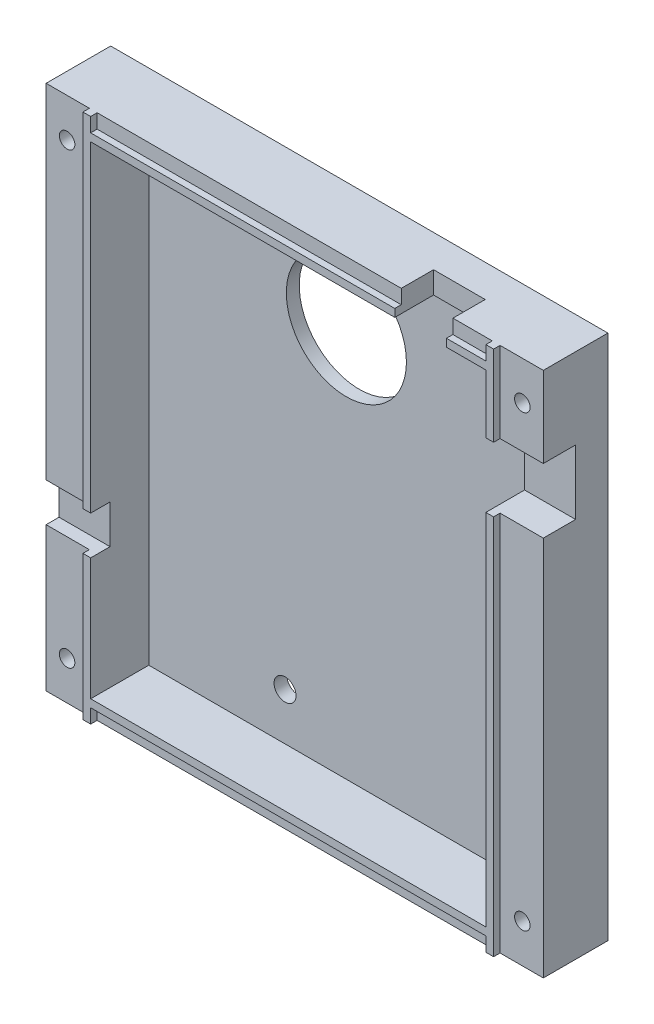
from build123d import *

# Parameters (mm, degrees)
SKETCH1_W            = 81.5
SKETCH1_H            = 77
BOSS_EXTRUDE1_DEPTH  = 2
SKETCH2_W            = 81.5
SKETCH2_H            = 6.7
BOSS_EXTRUDE2_DEPTH  = 8
SKETCH3_W            = 22.3
SKETCH3_H            = 6.7
BOSS_EXTRUDE3_DEPTH  = 10
SKETCH4_W            = 53.2
SKETCH4_H            = 6.7
BOSS_EXTRUDE4_DEPTH  = 10
SKETCH5_W            = 81.5
SKETCH5_H            = 1.2
BOSS_EXTRUDE5_DEPTH  = 8
SKETCH6_W            = 22.3
SKETCH6_H            = 1.2
BOSS_EXTRUDE6_DEPTH  = 11
SKETCH7_W            = 53.2
SKETCH7_H            = 1.2
BOSS_EXTRUDE7_DEPTH  = 11
SKETCH8_W            = 81.5
SKETCH8_H            = 6.7
BOSS_EXTRUDE8_DEPTH  = 5
SKETCH9_W            = 59
SKETCH9_H            = 6.7
BOSS_EXTRUDE9_DEPTH  = 10
SKETCH10_W           = 12.5
SKETCH10_H           = 6.7
BOSS_EXTRUDE10_DEPTH = 10
SKETCH11_W           = 81.5
SKETCH11_H           = 1.2
BOSS_EXTRUDE11_DEPTH = 5
SKETCH12_W           = 59
SKETCH12_H           = 1.2
BOSS_EXTRUDE12_DEPTH = 11
SKETCH13_W           = 12.5
SKETCH13_H           = 1.2
BOSS_EXTRUDE13_DEPTH = 11
SKETCH14_W           = 2.2
SKETCH14_H           = 63.6
BOSS_EXTRUDE14_DEPTH = 10
SKETCH15_W           = 1.2
SKETCH15_H           = 61.2
BOSS_EXTRUDE15_DEPTH = 11
SKETCH16_W           = 2.2
SKETCH16_H           = 63.6
BOSS_EXTRUDE16_DEPTH = 5
SKETCH17_W           = 2.2
SKETCH17_H           = 48.3
BOSS_EXTRUDE17_DEPTH = 10
SKETCH18_W           = 2.2
SKETCH18_H           = 7.3
BOSS_EXTRUDE18_DEPTH = 10
SKETCH19_W           = 1.2
SKETCH19_H           = 61.2
BOSS_EXTRUDE19_DEPTH = 5
SKETCH20_W           = 1.2
SKETCH20_H           = 47.1
BOSS_EXTRUDE20_DEPTH = 11
SKETCH21_W           = 1.2
SKETCH21_H           = 6.1
BOSS_EXTRUDE21_DEPTH = 11
SKETCH22_R           = 1.7
CUT_EXTRUDE1_DEPTH   = 17
SKETCH23_R           = 9.3
CUT_EXTRUDE2_DEPTH   = 17
SKETCH24_R           = 1.2
CUT_EXTRUDE3_DEPTH   = 17
SKETCH25_R           = 2
CUT_EXTRUDE4_DEPTH   = 1
SKETCH26_R           = 1.2
CUT_EXTRUDE5_DEPTH   = 17
SKETCH27_R           = 2
CUT_EXTRUDE6_DEPTH   = 1
SKETCH28_R           = 1.2
CUT_EXTRUDE7_DEPTH   = 17
SKETCH29_R           = 2
CUT_EXTRUDE8_DEPTH   = 1
SKETCH30_R           = 1.2
CUT_EXTRUDE9_DEPTH   = 17
SKETCH31_R           = 2
CUT_EXTRUDE10_DEPTH  = 1


with BuildPart() as part:
    # Sketch1 → Boss-Extrude1 (new body)
    with BuildSketch(Plane(origin=(0, 0, 0), x_dir=(0, 1, 0), z_dir=(0, 0, 1))):
        with Locations((40.75, -38.5)):
            Rectangle(SKETCH1_W, SKETCH1_H)
    extrude(amount=BOSS_EXTRUDE1_DEPTH)

    # Sketch2 → Boss-Extrude2 (add)
    with BuildSketch(Plane(origin=(0, 0, 0), x_dir=(0, 1, 0), z_dir=(0, 0, 1))):
        with Locations((40.75, -3.35)):
            Rectangle(SKETCH2_W, SKETCH2_H)
    extrude(amount=BOSS_EXTRUDE2_DEPTH)

    # Sketch3 → Boss-Extrude3 (add)
    with BuildSketch(Plane(origin=(0, 0, 0), x_dir=(0, 1, 0), z_dir=(0, 0, 1))):
        with Locations((11.15, -3.35)):
            Rectangle(SKETCH3_W, SKETCH3_H)
    extrude(amount=BOSS_EXTRUDE3_DEPTH)

    # Sketch4 → Boss-Extrude4 (add)
    with BuildSketch(Plane(origin=(0, 0, 0), x_dir=(0, 1, 0), z_dir=(0, 0, 1))):
        with Locations((54.9, -3.35)):
            Rectangle(SKETCH4_W, SKETCH4_H)
    extrude(amount=BOSS_EXTRUDE4_DEPTH)

    # Sketch5 → Boss-Extrude5 (add)
    with BuildSketch(Plane(origin=(0, 0, 0), x_dir=(0, 1, 0), z_dir=(0, 0, 1))):
        with Locations((40.75, -7.3)):
            Rectangle(SKETCH5_W, SKETCH5_H)
    extrude(amount=BOSS_EXTRUDE5_DEPTH)

    # Sketch6 → Boss-Extrude6 (add)
    with BuildSketch(Plane(origin=(0, 0, 0), x_dir=(0, 1, 0), z_dir=(0, 0, 1))):
        with Locations((11.15, -7.3)):
            Rectangle(SKETCH6_W, SKETCH6_H)
    extrude(amount=BOSS_EXTRUDE6_DEPTH)

    # Sketch7 → Boss-Extrude7 (add)
    with BuildSketch(Plane(origin=(0, 0, 0), x_dir=(0, 1, 0), z_dir=(0, 0, 1))):
        with Locations((54.9, -7.3)):
            Rectangle(SKETCH7_W, SKETCH7_H)
    extrude(amount=BOSS_EXTRUDE7_DEPTH)

    # Sketch8 → Boss-Extrude8 (add)
    with BuildSketch(Plane(origin=(0, 0, 0), x_dir=(0, 1, 0), z_dir=(0, 0, 1))):
        with Locations((40.75, -73.65)):
            Rectangle(SKETCH8_W, SKETCH8_H)
    extrude(amount=BOSS_EXTRUDE8_DEPTH)

    # Sketch9 → Boss-Extrude9 (add)
    with BuildSketch(Plane(origin=(0, 0, 0), x_dir=(0, 1, 0), z_dir=(0, 0, 1))):
        with Locations((29.5, -73.65)):
            Rectangle(SKETCH9_W, SKETCH9_H)
    extrude(amount=BOSS_EXTRUDE9_DEPTH)

    # Sketch10 → Boss-Extrude10 (add)
    with BuildSketch(Plane(origin=(0, 0, 0), x_dir=(0, 1, 0), z_dir=(0, 0, 1))):
        with Locations((75.25, -73.65)):
            Rectangle(SKETCH10_W, SKETCH10_H)
    extrude(amount=BOSS_EXTRUDE10_DEPTH)

    # Sketch11 → Boss-Extrude11 (add)
    with BuildSketch(Plane(origin=(0, 0, 0), x_dir=(0, 1, 0), z_dir=(0, 0, 1))):
        with Locations((40.75, -69.7)):
            Rectangle(SKETCH11_W, SKETCH11_H)
    extrude(amount=BOSS_EXTRUDE11_DEPTH)

    # Sketch12 → Boss-Extrude12 (add)
    with BuildSketch(Plane(origin=(0, 0, 0), x_dir=(0, 1, 0), z_dir=(0, 0, 1))):
        with Locations((29.5, -69.7)):
            Rectangle(SKETCH12_W, SKETCH12_H)
    extrude(amount=BOSS_EXTRUDE12_DEPTH)

    # Sketch13 → Boss-Extrude13 (add)
    with BuildSketch(Plane(origin=(0, 0, 0), x_dir=(0, 1, 0), z_dir=(0, 0, 1))):
        with Locations((75.25, -69.7)):
            Rectangle(SKETCH13_W, SKETCH13_H)
    extrude(amount=BOSS_EXTRUDE13_DEPTH)

    # Sketch14 → Boss-Extrude14 (add)
    with BuildSketch(Plane(origin=(0, 0, 0), x_dir=(0, 1, 0), z_dir=(0, 0, 1))):
        with Locations((1.1, -38.5)):
            Rectangle(SKETCH14_W, SKETCH14_H)
    extrude(amount=BOSS_EXTRUDE14_DEPTH)

    # Sketch15 → Boss-Extrude15 (add)
    with BuildSketch(Plane(origin=(0, 0, 0), x_dir=(0, 1, 0), z_dir=(0, 0, 1))):
        with Locations((2.8, -38.5)):
            Rectangle(SKETCH15_W, SKETCH15_H)
    extrude(amount=BOSS_EXTRUDE15_DEPTH)

    # Sketch16 → Boss-Extrude16 (add)
    with BuildSketch(Plane(origin=(0, 0, 0), x_dir=(0, 1, 0), z_dir=(0, 0, 1))):
        with Locations((80.4, -38.5)):
            Rectangle(SKETCH16_W, SKETCH16_H)
    extrude(amount=BOSS_EXTRUDE16_DEPTH)

    # Sketch17 → Boss-Extrude17 (add)
    with BuildSketch(Plane(origin=(0, 0, 0), x_dir=(0, 1, 0), z_dir=(0, 0, 1))):
        with Locations((80.4, -30.85)):
            Rectangle(SKETCH17_W, SKETCH17_H)
    extrude(amount=BOSS_EXTRUDE17_DEPTH)

    # Sketch18 → Boss-Extrude18 (add)
    with BuildSketch(Plane(origin=(0, 0, 0), x_dir=(0, 1, 0), z_dir=(0, 0, 1))):
        with Locations((80.4, -66.65)):
            Rectangle(SKETCH18_W, SKETCH18_H)
    extrude(amount=BOSS_EXTRUDE18_DEPTH)

    # Sketch19 → Boss-Extrude19 (add)
    with BuildSketch(Plane(origin=(0, 0, 0), x_dir=(0, 1, 0), z_dir=(0, 0, 1))):
        with Locations((78.7, -38.5)):
            Rectangle(SKETCH19_W, SKETCH19_H)
    extrude(amount=BOSS_EXTRUDE19_DEPTH)

    # Sketch20 → Boss-Extrude20 (add)
    with BuildSketch(Plane(origin=(0, 0, 0), x_dir=(0, 1, 0), z_dir=(0, 0, 1))):
        with Locations((78.7, -31.45)):
            Rectangle(SKETCH20_W, SKETCH20_H)
    extrude(amount=BOSS_EXTRUDE20_DEPTH)

    # Sketch21 → Boss-Extrude21 (add)
    with BuildSketch(Plane(origin=(0, 0, 0), x_dir=(0, 1, 0), z_dir=(0, 0, 1))):
        with Locations((78.7, -66.05)):
            Rectangle(SKETCH21_W, SKETCH21_H)
    extrude(amount=BOSS_EXTRUDE21_DEPTH)

    # Sketch22 → Cut-Extrude1 (cut)
    with BuildSketch(Plane(origin=(0, 0, 0), x_dir=(0, 1, 0), z_dir=(0, 0, 1))):
        with Locations(Location((10.7, -29, 0), (0, 0, 270))):
            Circle(SKETCH22_R)
    extrude(amount=CUT_EXTRUDE1_DEPTH, mode=Mode.SUBTRACT)

    # Sketch23 → Cut-Extrude2 (cut)
    with BuildSketch(Plane(origin=(0, 0, 0), x_dir=(0, 1, 0), z_dir=(0, 0, 1))):
        with Locations(Location((64, -38.5, 0), (0, 0, 270))):
            Circle(SKETCH23_R)
    extrude(amount=CUT_EXTRUDE2_DEPTH, mode=Mode.SUBTRACT)

    # Sketch24 → Cut-Extrude3 (cut)
    with BuildSketch(Plane(origin=(0, 0, 0), x_dir=(0, 1, 0), z_dir=(0, 0, 1))):
        with Locations(Location((6, -3.25, 0), (0, 0, 270))):
            Circle(SKETCH24_R)
    extrude(amount=CUT_EXTRUDE3_DEPTH, mode=Mode.SUBTRACT)

    # Sketch25 → Cut-Extrude4 (cut)
    with BuildSketch(Plane(origin=(0, 0, 0), x_dir=(0, 1, 0), z_dir=(0, 0, 1))):
        with Locations(Location((6, -3.25, 0), (0, 0, 270))):
            Circle(SKETCH25_R)
    extrude(amount=CUT_EXTRUDE4_DEPTH, mode=Mode.SUBTRACT)

    # Sketch26 → Cut-Extrude5 (cut)
    with BuildSketch(Plane(origin=(0, 0, 0), x_dir=(0, 1, 0), z_dir=(0, 0, 1))):
        with Locations(Location((75.5, -3.25, 0), (0, 0, 270))):
            Circle(SKETCH26_R)
    extrude(amount=CUT_EXTRUDE5_DEPTH, mode=Mode.SUBTRACT)

    # Sketch27 → Cut-Extrude6 (cut)
    with BuildSketch(Plane(origin=(0, 0, 0), x_dir=(0, 1, 0), z_dir=(0, 0, 1))):
        with Locations(Location((75.5, -3.25, 0), (0, 0, 270))):
            Circle(SKETCH27_R)
    extrude(amount=CUT_EXTRUDE6_DEPTH, mode=Mode.SUBTRACT)

    # Sketch28 → Cut-Extrude7 (cut)
    with BuildSketch(Plane(origin=(0, 0, 0), x_dir=(0, 1, 0), z_dir=(0, 0, 1))):
        with Locations(Location((6, -73.75, 0), (0, 0, 270))):
            Circle(SKETCH28_R)
    extrude(amount=CUT_EXTRUDE7_DEPTH, mode=Mode.SUBTRACT)

    # Sketch29 → Cut-Extrude8 (cut)
    with BuildSketch(Plane(origin=(0, 0, 0), x_dir=(0, 1, 0), z_dir=(0, 0, 1))):
        with Locations(Location((6, -73.75, 0), (0, 0, 270))):
            Circle(SKETCH29_R)
    extrude(amount=CUT_EXTRUDE8_DEPTH, mode=Mode.SUBTRACT)

    # Sketch30 → Cut-Extrude9 (cut)
    with BuildSketch(Plane(origin=(0, 0, 0), x_dir=(0, 1, 0), z_dir=(0, 0, 1))):
        with Locations(Location((75.5, -73.75, 0), (0, 0, 270))):
            Circle(SKETCH30_R)
    extrude(amount=CUT_EXTRUDE9_DEPTH, mode=Mode.SUBTRACT)

    # Sketch31 → Cut-Extrude10 (cut)
    with BuildSketch(Plane(origin=(0, 0, 0), x_dir=(0, 1, 0), z_dir=(0, 0, 1))):
        with Locations(Location((75.5, -73.75, 0), (0, 0, 270))):
            Circle(SKETCH31_R)
    extrude(amount=CUT_EXTRUDE10_DEPTH, mode=Mode.SUBTRACT)


solid = part.part
